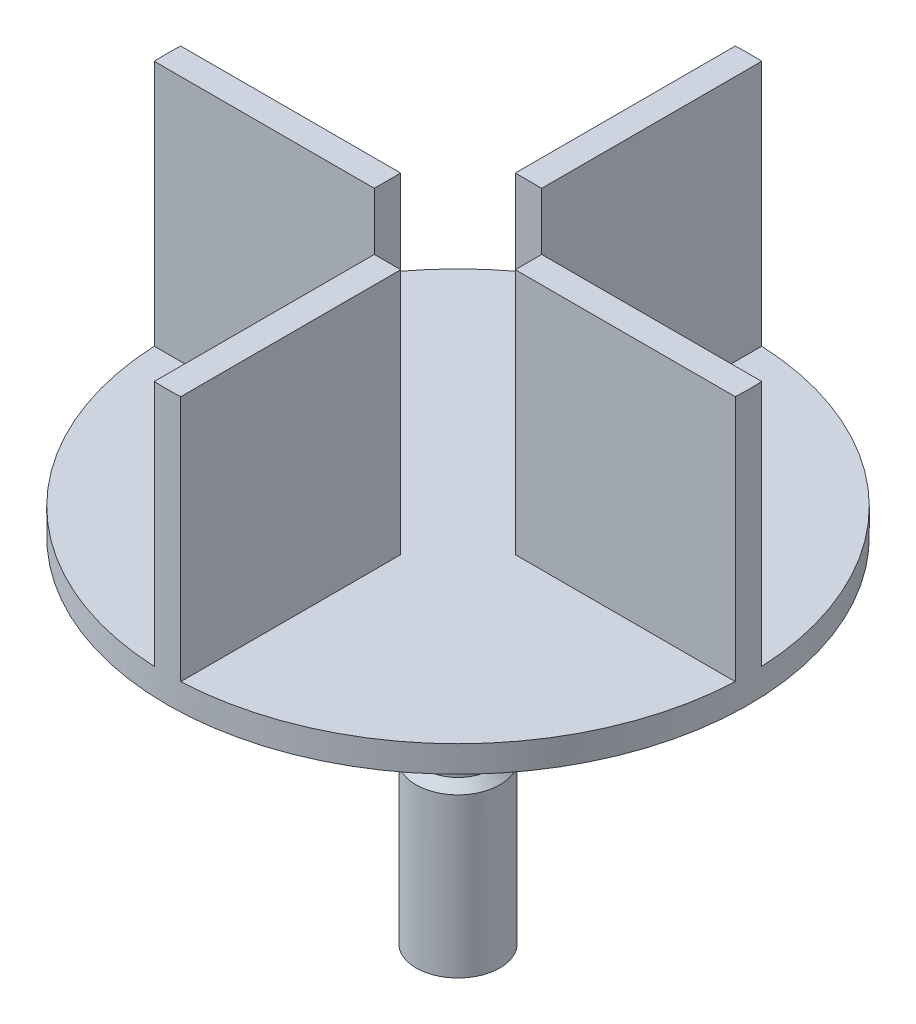
from build123d import *

# Parameters (mm, degrees)
SKETCH1_R           = 33
BOSS_EXTRUDE1_DEPTH = 3
BOSS_EXTRUDE2_DEPTH = 28
CIRPATTERN1_COUNT   = 4
SKETCH5_R           = 4.75
BOSS_EXTRUDE3_DEPTH = 40


with BuildPart() as part:
    # Sketch1 → Boss-Extrude1 (new body)
    with BuildSketch(Plane(origin=(0, 0, 0), x_dir=(1, 0, 0), z_dir=(0, 1, 0))):
        with Locations(Location((0, 0, 0), (0, 0, 270))):
            Circle(SKETCH1_R)
    extrude(amount=BOSS_EXTRUDE1_DEPTH)

    # Sketch2 → Boss-Extrude2 (add)
    with BuildSketch(Plane(origin=(0, 3, 0), x_dir=(1, 0, 0), z_dir=(0, 1, 0))):
        with BuildLine():
            ThreePointArc((1.5, 32.965891464), (0.750193874, 32.991471764), (0, 33))
            Line((0, 33), (0, 8))
            Line((0, 8), (1.5, 8))
            Line((1.5, 8), (1.5, 32.965891464))
        make_face()
        with BuildLine():
            Line((0, 8), (0, 33))
            ThreePointArc((0, 33), (-0.750193874, 32.991471764), (-1.5, 32.965891464))
            Line((-1.5, 32.965891464), (-1.5, 8))
            Line((-1.5, 8), (0, 8))
        make_face()
    boss_extrude2 = extrude(amount=BOSS_EXTRUDE2_DEPTH)

    # CirPattern1: Boss-Extrude2 ×4 about axis
    cirpattern1_axis = Axis((0, 0, 0), (0, 1, 0))
    for i in range(1, CIRPATTERN1_COUNT):
        add(boss_extrude2.rotate(cirpattern1_axis, i * 360 / CIRPATTERN1_COUNT))

    # Sketch5 → Boss-Extrude3 (add)
    with BuildSketch(Plane.XZ):
        with Locations(Location((0, 0, 0), (0, 0, 90))):
            Circle(SKETCH5_R)
    extrude(amount=BOSS_EXTRUDE3_DEPTH)

    # Sketch6 → Cut-Revolve1 (revolve, cut)
    with BuildSketch(Plane.XY, mode=Mode.PRIVATE) as cut_revolve1_sk:
        Polygon((-4.75, -16), (-3.75, -17), (-3.75, -21), (-4.75, -22), align=None)
    revolve(cut_revolve1_sk.sketch.rotate(Axis((0, 0, 0), (0, -1, 0)), 270), axis=Axis((0, 0, 0), (0, -1, 0)), mode=Mode.SUBTRACT)


solid = part.part
